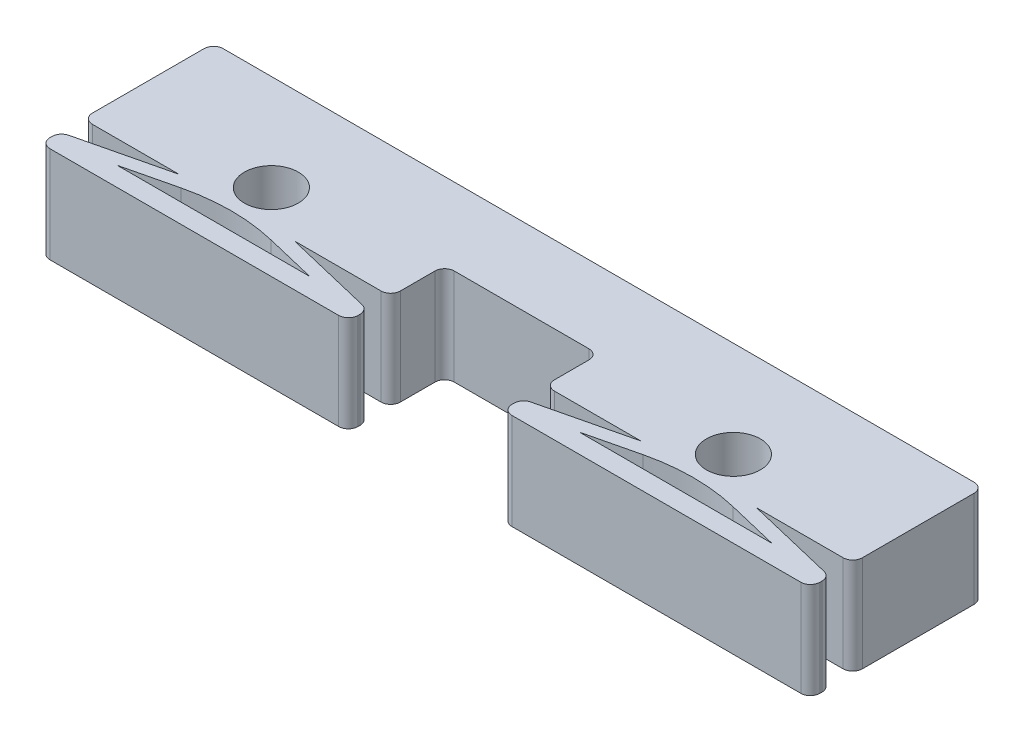
from build123d import *

# Parameters (mm, degrees)
BOSS_EXTRUDE1_DEPTH     = 5
CUT_EXTRUDE1_DEPTH      = 5
CUT_EXTRUDE1_DEPTH_BACK = 10
SKETCH2_R               = 1.4
FILLET1_R               = 10
FILLET2_R               = 0.5


with BuildPart() as part:
    # Sketch1 → Boss-Extrude1 (new body)
    with BuildSketch(Plane(origin=(0, 0, 0), x_dir=(1, 0, 0), z_dir=(0, 1, 0))):
        Polygon((0, 0), (0, 9), (40, 9), (40, 0), (24, 0), (24, 5), (16, 5), (16, 0), align=None)
    extrude(amount=BOSS_EXTRUDE1_DEPTH)

    # Sketch2 → Cut-Extrude1 (cut, two sides: drawn at the far end of the back side and taken through both)
    with BuildSketch(Plane(origin=(0, 5, 0), x_dir=(1, 0, 0), z_dir=(0, 1, 0)).offset(-CUT_EXTRUDE1_DEPTH_BACK)):
        with Locations(Location((8, 4, 0), (0, 0, 270))):
            Circle(SKETCH2_R)
        with Locations(Location((32, 4, 0), (0, 0, 270))):
            Circle(SKETCH2_R)
        Polygon((5, 2.2), (0, 2.2), (0, 1), align=None)
        Polygon((13, 1), (8, 2.2), (3, 1), align=None)
        Polygon((16, 2.2), (11, 2.2), (16, 1), align=None)
        Polygon((24, 2.2), (24, 1), (29, 2.2), align=None)
        Polygon((32, 2.2), (27, 1), (37, 1), align=None)
        Polygon((40, 2.2), (35, 2.2), (40, 1), align=None)
    extrude(amount=CUT_EXTRUDE1_DEPTH + CUT_EXTRUDE1_DEPTH_BACK, mode=Mode.SUBTRACT)

    # Fillet1
    fillet1_edges = [part.edges().sort_by_distance(p)[0] for p in [
        (32, 2.5, -2.2),
        (8, 2.5, -2.2),
    ]]
    fillet(fillet1_edges, radius=FILLET1_R)

    # Fillet2
    fillet2_edges = [part.edges().sort_by_distance(p)[0] for p in [
        (0, 2.5, 0),
        (0, 2.5, -9),
        (40, 2.5, -9),
        (40, 2.5, 0),
        (24, 2.5, 0),
        (24, 2.5, -5),
        (16, 2.5, -5),
        (16, 2.5, 0),
        (0, 2.5, -1),
        (0, 2.5, -2.2),
        (16, 2.5, -2.2),
        (16, 2.5, -1),
        (24, 2.5, -2.2),
        (24, 2.5, -1),
        (40, 2.5, -2.2),
        (40, 2.5, -1),
    ]]
    fillet(fillet2_edges, radius=FILLET2_R)


solid = part.part
